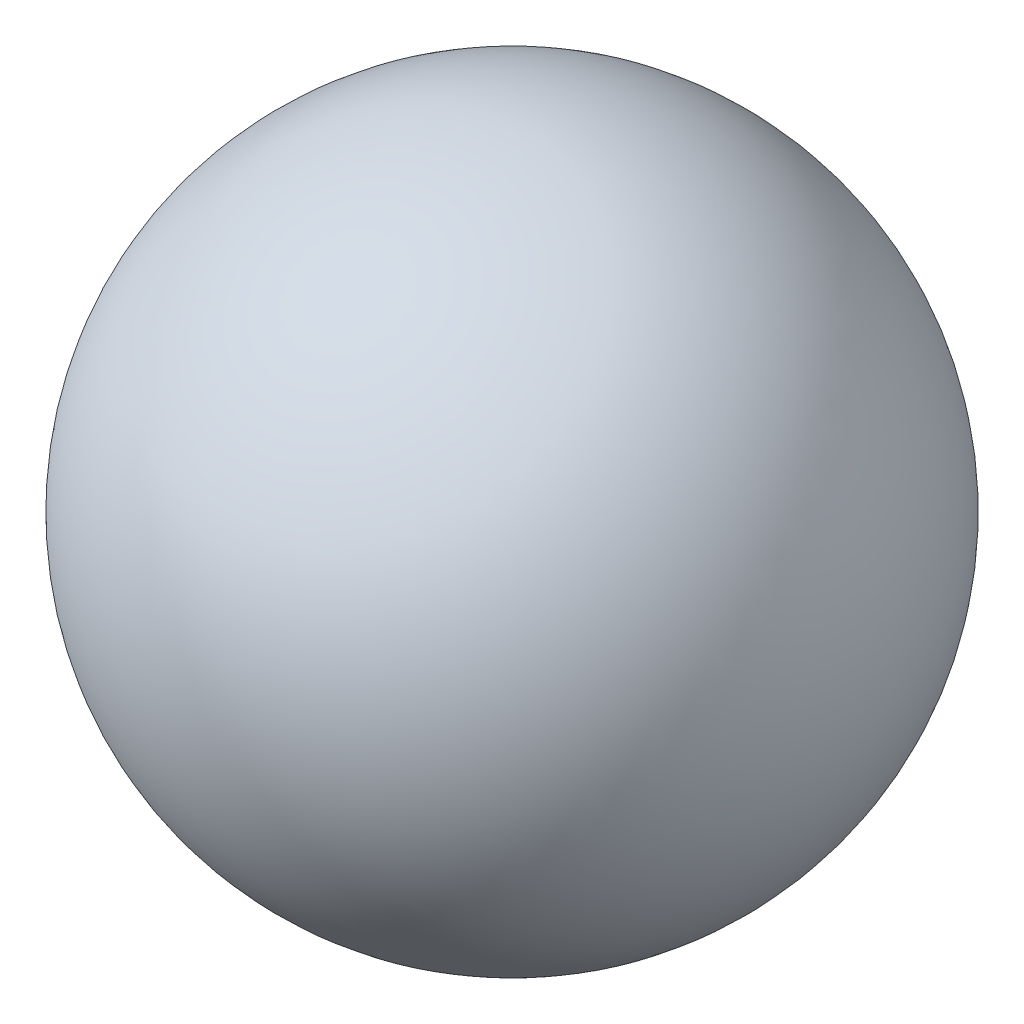
from build123d import *


with BuildPart() as part:
    # Sketch2 → Revolve1 (revolve)
    with BuildSketch(Plane.XY):
        with BuildLine():
            Line((0, 50.8), (0, -50.8))
            ThreePointArc((0, -50.8), (-50.8, 0), (0, 50.8))
        make_face()
    revolve(axis=Axis((0, 50.8, 0), (0, -1, 0)))


solid = part.part
